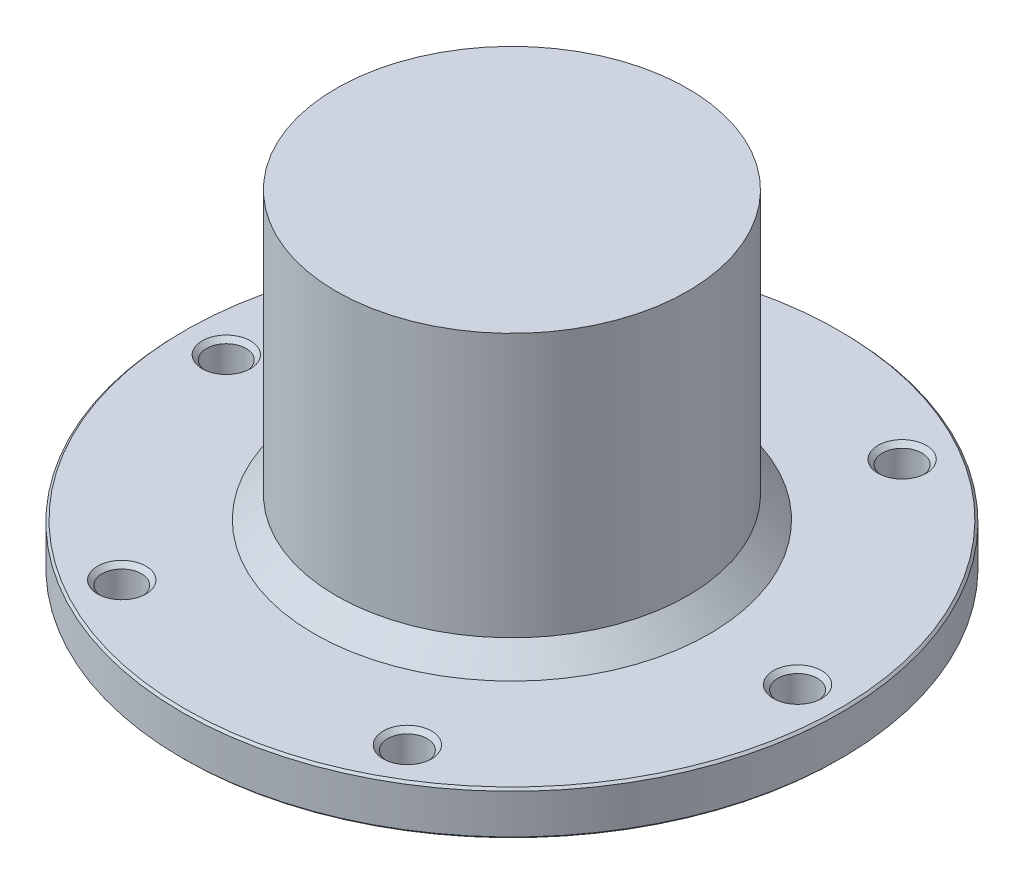
from build123d import *

# Parameters (mm, degrees)
SKIZZE1_R                       = 150
SKIZZE1_R_2                     = 9
AUFSATZ_LINEAR_AUSTRAGEN1_DEPTH = 20
SKIZZE3_R                       = 80
AUFSATZ_LINEAR_AUSTRAGEN2_DEPTH = 130
FASE1_SIZE                      = 1
FASE2_SIZE                      = 10
FASE3_SIZE                      = 2


with BuildPart() as part:
    # Skizze1 → Aufsatz-Linear austragen1 (new body)
    with BuildSketch(Plane(origin=(0, 0, 0), x_dir=(1, 0, 0), z_dir=(0, 1, 0))):
        with Locations(Location((0, 0, 0), (0, 0, 270))):
            Circle(SKIZZE1_R)
        with Locations(Location((130, 0, 0), (0, 0, 270))):
            Circle(SKIZZE1_R_2, mode=Mode.SUBTRACT)
        with Locations(Location((65, -112.583302492, 0), (0, 0, 270))):
            Circle(SKIZZE1_R_2, mode=Mode.SUBTRACT)
        with Locations(Location((-65, -112.583302492, 0), (0, 0, 270))):
            Circle(SKIZZE1_R_2, mode=Mode.SUBTRACT)
        with Locations(Location((-130, 0, 0), (0, 0, 270))):
            Circle(SKIZZE1_R_2, mode=Mode.SUBTRACT)
        with Locations(Location((-65, 112.583302492, 0), (0, 0, 270))):
            Circle(SKIZZE1_R_2, mode=Mode.SUBTRACT)
        with Locations(Location((65, 112.583302492, 0), (0, 0, 270))):
            Circle(SKIZZE1_R_2, mode=Mode.SUBTRACT)
    extrude(amount=AUFSATZ_LINEAR_AUSTRAGEN1_DEPTH)

    # Skizze3 → Aufsatz-Linear austragen2 (add)
    with BuildSketch(Plane(origin=(0, 20, 0), x_dir=(1, 0, 0), z_dir=(0, 1, 0))):
        with Locations(Location((0, 0, 0), (0, 0, 270))):
            Circle(SKIZZE3_R)
    extrude(amount=AUFSATZ_LINEAR_AUSTRAGEN2_DEPTH)

    # Fase1
    fase1_edges = [part.edges().sort_by_distance(p)[0] for p in [
        (0, 0, -150),
        (0, 20, -150),
    ]]
    chamfer(fase1_edges, length=FASE1_SIZE)

    # Fase2
    fase2_edges = [part.edges().sort_by_distance(p)[0] for p in [
        (0, 20, -80),
    ]]
    chamfer(fase2_edges, length=FASE2_SIZE)

    # Fase3
    fase3_edges = [part.edges().sort_by_distance(p)[0] for p in [
        (-65, 0, 103.583302492),
        (-65, 20, 103.583302492),
        (-130, 0, -9),
        (-130, 20, -9),
        (-65, 0, -121.583302492),
        (-65, 20, -121.583302492),
        (65, 0, -121.583302492),
        (65, 20, -121.583302492),
        (130, 0, -9),
        (130, 20, -9),
        (65, 0, 103.583302492),
        (65, 20, 103.583302492),
    ]]
    chamfer(fase3_edges, length=FASE3_SIZE)


solid = part.part
